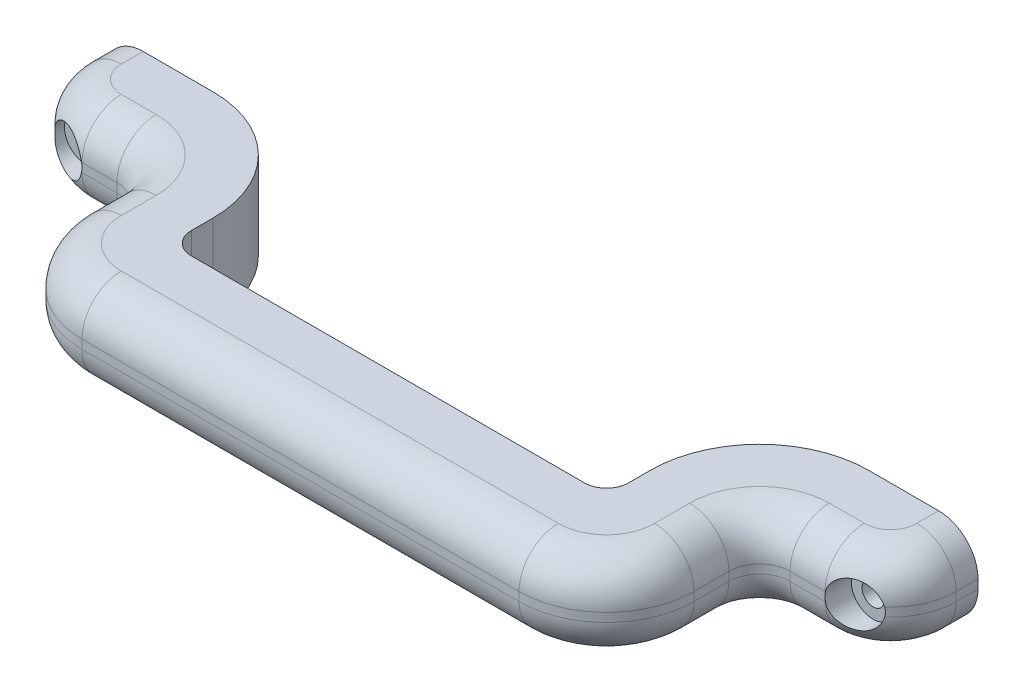
from build123d import *

# Parameters (mm, degrees)
EXTRUDE_1_DEPTH     = 20
FILLET_1_R          = 9
SKETCH_2_R          = 2.55
CUT_EXTRUDE_1_DEPTH = 135.75780331
SKETCH_3_R          = 5
CUT_EXTRUDE_2_DEPTH = 6


with BuildPart() as part:
    # Эскиз1 → Бобышка-Вытянуть1 (new body)
    with BuildSketch(Plane(origin=(0, 0, 0), x_dir=(1, 0, 0), z_dir=(0, 1, 0))):
        with BuildLine():
            Line((-78.613569322, 20), (-53.613569322, 20))
            ThreePointArc((-53.613569322, 20), (-35.935899792, 12.67766953), (-28.613569322, -5))
            Line((-28.613569322, -5), (-28.613569322, -10))
            ThreePointArc((-28.613569322, -10), (-27.149103227, -13.535533906), (-23.613569322, -15))
            Line((-23.613569322, -15), (66.386430678, -15))
            ThreePointArc((66.386430678, -15), (69.921964584, -13.535533906), (71.386430678, -10))
            Line((71.386430678, -10), (71.386430678, -5))
            ThreePointArc((71.386430678, -5), (78.708761149, 12.67766953), (96.386430678, 20))
            Line((96.386430678, 20), (121.386430678, 20))
            Line((121.386430678, 20), (121.386430678, 15))
            ThreePointArc((121.386430678, 15), (116.993032396, 4.393398282), (106.386430678, 0))
            Line((106.386430678, 0), (98.386430678, 0))
            ThreePointArc((98.386430678, 0), (93.43668321, -2.050252532), (91.386430678, -7))
            Line((91.386430678, -7), (91.386430678, -15))
            ThreePointArc((91.386430678, -15), (85.528566302, -29.142135624), (71.386430678, -35))
            Line((71.386430678, -35), (-28.613569322, -35))
            ThreePointArc((-28.613569322, -35), (-42.755704945, -29.142135624), (-48.613569322, -15))
            Line((-48.613569322, -15), (-48.613569322, -7))
            ThreePointArc((-48.613569322, -7), (-50.663821853, -2.050252532), (-55.613569322, 0))
            Line((-55.613569322, 0), (-63.613569322, 0))
            ThreePointArc((-63.613569322, 0), (-74.220171039, 4.393398282), (-78.613569322, 15))
            Line((-78.613569322, 15), (-78.613569322, 20))
        make_face()
    extrude(amount=EXTRUDE_1_DEPTH)

    # Скругление1
    fillet_1_edges = [part.edges().sort_by_distance(p)[0] for p in [
        (-59.613569322, 20, 0),
        (-50.663821853, 20, 2.050252532),
        (-48.613569322, 20, 11),
        (-42.755704945, 20, 29.142135624),
        (21.386430678, 20, 35),
        (121.386430678, 0, -17.5),
        (116.993032396, 0, -4.393398282),
        (102.386430678, 0, 0),
        (93.43668321, 0, 2.050252532),
        (91.386430678, 0, 11),
        (85.528566302, 0, 29.142135624),
        (21.386430678, 0, 35),
        (85.528566302, 20, 29.142135624),
        (-42.755704945, 0, 29.142135624),
        (-48.613569322, 0, 11),
        (-50.663821853, 0, 2.050252532),
        (-59.613569322, 0, 0),
        (-74.220171039, 0, -4.393398282),
        (-78.613569322, 0, -17.5),
        (91.386430678, 20, 11),
        (93.43668321, 20, 2.050252532),
        (102.386430678, 20, 0),
        (116.993032396, 20, -4.393398282),
        (-78.613569322, 20, -17.5),
        (121.386430678, 20, -17.5),
        (-74.220171039, 20, -4.393398282),
    ]]
    fillet(fillet_1_edges, radius=FILLET_1_R)

    # Эскиз2 → Вырез-Вытянуть1 (cut, through all)
    with BuildSketch(Plane(origin=(0, 0, -20), x_dir=(-1, 0, 0), z_dir=(0, 0, -1))):
        with Locations((-111.386430678, 10)):
            Circle(SKETCH_2_R)
        with Locations((68.613569322, 10)):
            Circle(SKETCH_2_R)
    extrude(amount=-CUT_EXTRUDE_1_DEPTH, mode=Mode.SUBTRACT)

    # Эскиз3 → Вырез-Вытянуть2 (cut)
    with BuildSketch(Plane.XY):
        with Locations((-68.613569322, 10)):
            Circle(SKETCH_3_R)
        with Locations((111.386430678, 10)):
            Circle(SKETCH_3_R)
    extrude(amount=-CUT_EXTRUDE_2_DEPTH, mode=Mode.SUBTRACT)


solid = part.part
